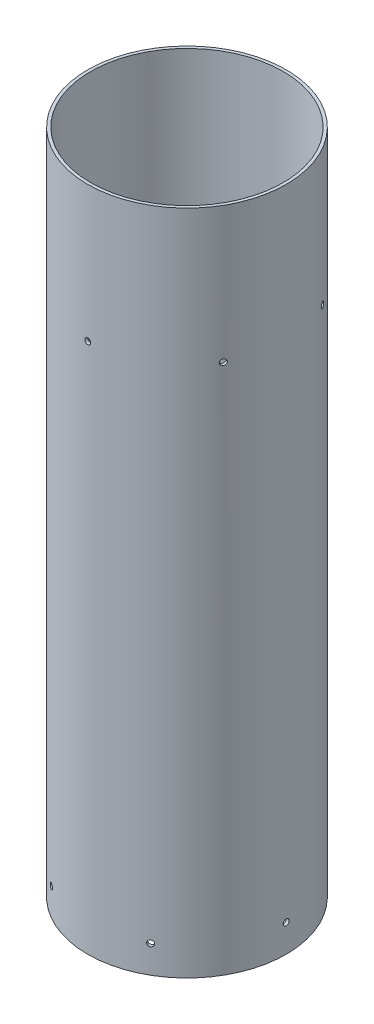
from build123d import *

# Parameters (mm, degrees)
SKETCH3_R           = 51.054
SKETCH3_R_2         = 49.53
BOSS_EXTRUDE1_DEPTH = 342.9
SKETCH4_R           = 1.524
CUT_EXTRUDE1_DEPTH  = 71.12
CIRPATTERN1_COUNT   = 6
SKETCH5_R           = 1.524
CUT_EXTRUDE2_DEPTH  = 177.8
CIRPATTERN2_COUNT   = 6


with BuildPart() as part:
    # Sketch3 → Boss-Extrude1 (new body)
    with BuildSketch(Plane(origin=(0, 0, 0), x_dir=(1, 0, 0), z_dir=(0, 1, 0))):
        with Locations(Location((0, 0, 0), (0, 0, 270))):
            Circle(SKETCH3_R)
        with Locations(Location((0, 0, 0), (0, 0, 270))):
            Circle(SKETCH3_R_2, mode=Mode.SUBTRACT)
    extrude(amount=BOSS_EXTRUDE1_DEPTH)

    # Sketch4 → Cut-Extrude1 (cut)
    with BuildSketch(Plane.XY):
        with Locations(Location((0, 273.05, 0), (0, 0, 90))):
            Circle(SKETCH4_R)
    cut_extrude1 = extrude(amount=-CUT_EXTRUDE1_DEPTH, mode=Mode.SUBTRACT)

    # CirPattern1: Cut-Extrude1 ×6 about axis
    cirpattern1_axis = Axis((0, 342.9, 0), (0, -1, 0))
    for i in range(1, CIRPATTERN1_COUNT):
        add(cut_extrude1.rotate(cirpattern1_axis, i * 360 / CIRPATTERN1_COUNT), mode=Mode.SUBTRACT)

    # Sketch5 → Cut-Extrude2 (cut)
    with BuildSketch(Plane(origin=(0, 0, 0), x_dir=(0, 0, -1), z_dir=(1, 0, 0))):
        with Locations((0, 14.224)):
            Circle(SKETCH5_R)
    cut_extrude2 = extrude(amount=-CUT_EXTRUDE2_DEPTH, mode=Mode.SUBTRACT)

    # CirPattern2: Cut-Extrude2 ×6 about axis
    cirpattern2_axis = Axis((0, 342.9, 0), (0, -1, 0))
    for i in range(1, CIRPATTERN2_COUNT):
        add(cut_extrude2.rotate(cirpattern2_axis, i * 360 / CIRPATTERN2_COUNT), mode=Mode.SUBTRACT)


solid = part.part
